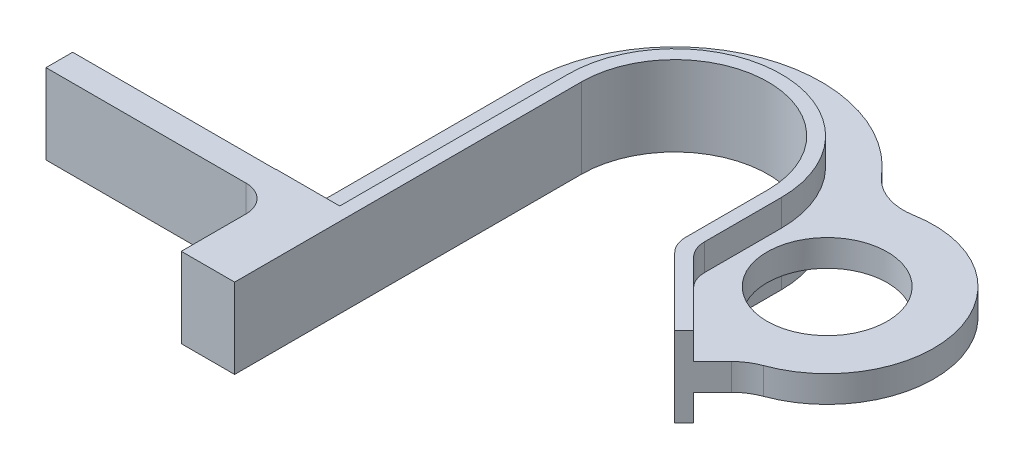
from build123d import *

# Parameters (mm, degrees)
BOSS_EXTRUDE1_DEPTH = 19.05
CUT_EXTRUDE3_START  = -6.35
CUT_EXTRUDE3_DEPTH  = 6.35
FILLET1_R           = 6.35
FILLET2_R           = 6.35
SKETCH4_W           = 6.35
SKETCH4_H           = 19.05
BOSS_EXTRUDE2_DEPTH = 63.5
SKETCH6_W           = 12.7
SKETCH6_H           = 19.05
BOSS_EXTRUDE3_DEPTH = 28.194
FILLET4_R           = 6.35
FILLET5_R           = 6.35
BOSS_EXTRUDE4_DEPTH = 6.35
FILLET6_R           = 12.7
FILLET7_R           = 12.7
SKETCH9_R           = 14.309078451
CUT_EXTRUDE5_DEPTH  = 122.979516723


with BuildPart() as part:
    # Sketch1 → Boss-Extrude1 (new body)
    with BuildSketch(Plane(origin=(0, 0, 0), x_dir=(1, 0, 0), z_dir=(0, 1, 0))):
        with BuildLine():
            Line((-22.225, 0), (-22.225, -82.55))
            Line((-22.225, -82.55), (-34.925, -82.55))
            Line((-34.925, -82.55), (-34.925, 0))
            ThreePointArc((-34.925, 0), (0, 34.925), (34.925, 0))
            Line((34.925, 0), (34.925, -16.964487758))
            Line((34.925, -16.964487758), (49.165768363, -31.205256121))
            Line((49.165768363, -31.205256121), (40.185512242, -40.185512242))
            Line((40.185512242, -40.185512242), (22.225, -22.225))
            Line((22.225, -22.225), (22.225, 0))
            ThreePointArc((22.225, 0), (0, 22.225), (-22.225, 0))
        make_face()
    extrude(amount=BOSS_EXTRUDE1_DEPTH)

    # Sketch3 → Cut-Extrude3 (cut)
    with BuildSketch(Plane(origin=(0, 19.05, 0), x_dir=(1, 0, 0), z_dir=(0, 1, 0)).offset(CUT_EXTRUDE3_START)):
        with BuildLine():
            Line((-34.925, 0), (-34.925, -82.55))
            Line((-34.925, -82.55), (-25.4, -82.55))
            Line((-25.4, -82.55), (-25.4, 0))
            ThreePointArc((-25.4, 0), (0, 25.4), (25.4, 0))
            Line((25.4, 0), (25.4, -20.909871939))
            Line((25.4, -20.909871939), (42.430576272, -37.940448212))
            Line((42.430576272, -37.940448212), (49.165768363, -31.205256121))
            Line((49.165768363, -31.205256121), (34.925, -16.964487758))
            Line((34.925, -16.964487758), (34.925, 0))
            ThreePointArc((34.925, 0), (0, 34.925), (-34.925, 0))
        make_face()
    cut_extrude3 = extrude(amount=CUT_EXTRUDE3_DEPTH, mode=Mode.SUBTRACT)

    # Mirror1: Cut-Extrude3 across plane
    add(cut_extrude3.mirror(Plane.ZX.offset(9.525)), mode=Mode.SUBTRACT)

    # Fillet1
    fillet1_edges = [part.edges().sort_by_distance(p)[0] for p in [
        (34.925, 9.525, 16.964487758),
        (25.4, 15.875, 20.909871939),
        (25.4, 3.175, 20.909871939),
    ]]
    fillet(fillet1_edges, radius=FILLET1_R)

    # Fillet2
    fillet2_edges = [part.edges().sort_by_distance(p)[0] for p in [
        (22.225, 9.525, 22.225),
    ]]
    fillet(fillet2_edges, radius=FILLET2_R)

    # Sketch4 → Boss-Extrude2 (add)
    with BuildSketch(Plane.ZY.offset(25.4)):
        with Locations((57.6072, 9.525)):
            Rectangle(SKETCH4_W, SKETCH4_H)
    extrude(amount=BOSS_EXTRUDE2_DEPTH)

    # Sketch6 → Boss-Extrude3 (add)
    with BuildSketch(Plane.XY.offset(82.55)):
        with Locations((-28.575, 9.525)):
            Rectangle(SKETCH6_W, SKETCH6_H)
    extrude(amount=-BOSS_EXTRUDE3_DEPTH)

    # Fillet4
    fillet4_edges = [part.edges().sort_by_distance(p)[0] for p in [
        (-34.925, 9.525, 60.7822),
    ]]
    fillet(fillet4_edges, radius=FILLET4_R)

    # Fillet5
    fillet5_edges = [part.edges().sort_by_distance(p)[0] for p in [
        (-34.925, 9.525, 54.4322),
    ]]
    fillet(fillet5_edges, radius=FILLET5_R)

    # Sketch8 → Boss-Extrude4 (add)
    with BuildSketch(Plane(origin=(0, 12.7, 0), x_dir=(1, 0, 0), z_dir=(0, 1, 0))):
        with BuildLine():
            Line((34.925, -14.334231637), (34.925, 0))
            ThreePointArc((34.925, 0), (33.953727024, 8.179244844), (31.093930783, 15.903556001))
            ThreePointArc((31.093930783, 15.903556001), (66.598964527, 2.503206576), (49.165768363, -31.205256121))
            Line((49.165768363, -31.205256121), (36.784871939, -18.824359697))
            ThreePointArc((36.784871939, -18.824359697), (35.408364969, -16.764271432), (34.925, -14.334231637))
        make_face()
    extrude(amount=-BOSS_EXTRUDE4_DEPTH)

    # Fillet6
    fillet6_edges = [part.edges().sort_by_distance(p)[0] for p in [
        (31.093930783, 9.525, -15.903556001),
    ]]
    fillet(fillet6_edges, radius=FILLET6_R)

    # Fillet7
    fillet7_edges = [part.edges().sort_by_distance(p)[0] for p in [
        (49.165768363, 9.525, 31.205256121),
    ]]
    fillet(fillet7_edges, radius=FILLET7_R)

    # Sketch9 → Cut-Extrude5 (cut, through all)
    with BuildSketch(Plane(origin=(0, 12.7, 0), x_dir=(1, 0, 0), z_dir=(0, 1, 0))):
        with Locations(Location((42.884078451, -6.594275404, 0), (0, 0, 270))):
            Circle(SKETCH9_R)
    extrude(amount=-CUT_EXTRUDE5_DEPTH, mode=Mode.SUBTRACT)


solid = part.part
